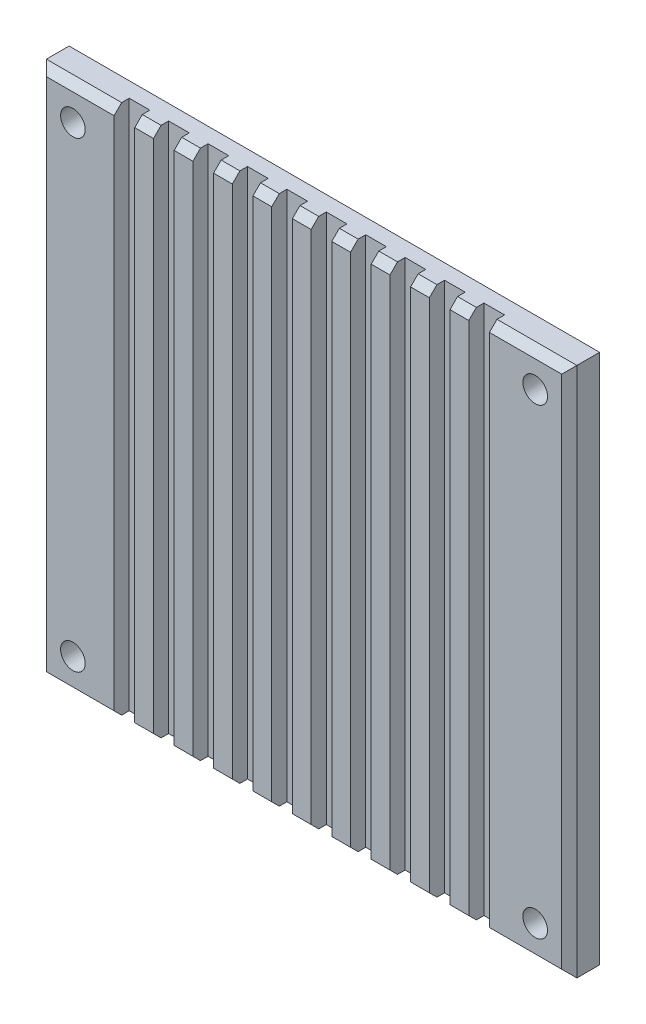
from build123d import *

# Parameters (mm, degrees)
SKETCH1_W           = 70
SKETCH1_H           = 70
SKETCH1_R           = 1.625
BOSS_EXTRUDE1_DEPTH = 4
SKETCH2_W           = 2.725639952
SKETCH2_H           = 70
CUT_EXTRUDE1_DEPTH  = 2
CHAMFER1_SIZE       = 1


with BuildPart() as part:
    # Sketch1 → Boss-Extrude1 (new body)
    with BuildSketch(Plane.XY):
        with Locations((35, 35)):
            Rectangle(SKETCH1_W, SKETCH1_H)
        with Locations((4.5, 65.5)):
            Circle(SKETCH1_R, mode=Mode.SUBTRACT)
        with Locations((65.5, 65.5)):
            Circle(SKETCH1_R, mode=Mode.SUBTRACT)
        with Locations((65.5, 4.5)):
            Circle(SKETCH1_R, mode=Mode.SUBTRACT)
        with Locations((4.5, 4.5)):
            Circle(SKETCH1_R, mode=Mode.SUBTRACT)
    extrude(amount=BOSS_EXTRUDE1_DEPTH)

    # Sketch2 → Cut-Extrude1 (cut)
    with BuildSketch(Plane.XY.offset(4)):
        with Locations((11.296666841, 35)):
            Rectangle(SKETCH2_W, SKETCH2_H)
        with Locations((16.496666841, 35)):
            Rectangle(SKETCH2_W, SKETCH2_H)
        with Locations((21.696666841, 35)):
            Rectangle(SKETCH2_W, SKETCH2_H)
        with Locations((26.896666841, 35)):
            Rectangle(SKETCH2_W, SKETCH2_H)
        with Locations((32.096666841, 35)):
            Rectangle(SKETCH2_W, SKETCH2_H)
        with Locations((37.296666841, 35)):
            Rectangle(SKETCH2_W, SKETCH2_H)
        with Locations((42.496666841, 35)):
            Rectangle(SKETCH2_W, SKETCH2_H)
        with Locations((47.696666841, 35)):
            Rectangle(SKETCH2_W, SKETCH2_H)
        with Locations((52.896666841, 35)):
            Rectangle(SKETCH2_W, SKETCH2_H)
        with Locations((58.096666841, 35)):
            Rectangle(SKETCH2_W, SKETCH2_H)
    extrude(amount=-CUT_EXTRUDE1_DEPTH, mode=Mode.SUBTRACT)

    # Chamfer1
    chamfer1_edges = [part.edges().sort_by_distance(p)[0] for p in [
        (70, 35, 4),
        (64.729743409, 70, 4),
        (55.496666841, 70, 4),
        (50.296666841, 70, 4),
        (45.096666841, 70, 4),
        (39.896666841, 70, 4),
        (34.696666841, 70, 4),
        (29.496666841, 70, 4),
        (24.296666841, 70, 4),
        (19.096666841, 70, 4),
        (13.896666841, 70, 4),
        (4.966923432, 70, 4),
        (0, 35, 4),
        (13.896666841, 0, 4),
        (19.096666841, 0, 4),
        (24.296666841, 0, 4),
        (29.496666841, 0, 4),
        (34.696666841, 0, 4),
        (39.896666841, 0, 4),
        (45.096666841, 0, 4),
        (50.296666841, 0, 4),
        (55.496666841, 0, 4),
        (64.729743409, 0, 4),
        (4.966923432, 0, 4),
    ]]
    chamfer(chamfer1_edges, length=CHAMFER1_SIZE)


solid = part.part
